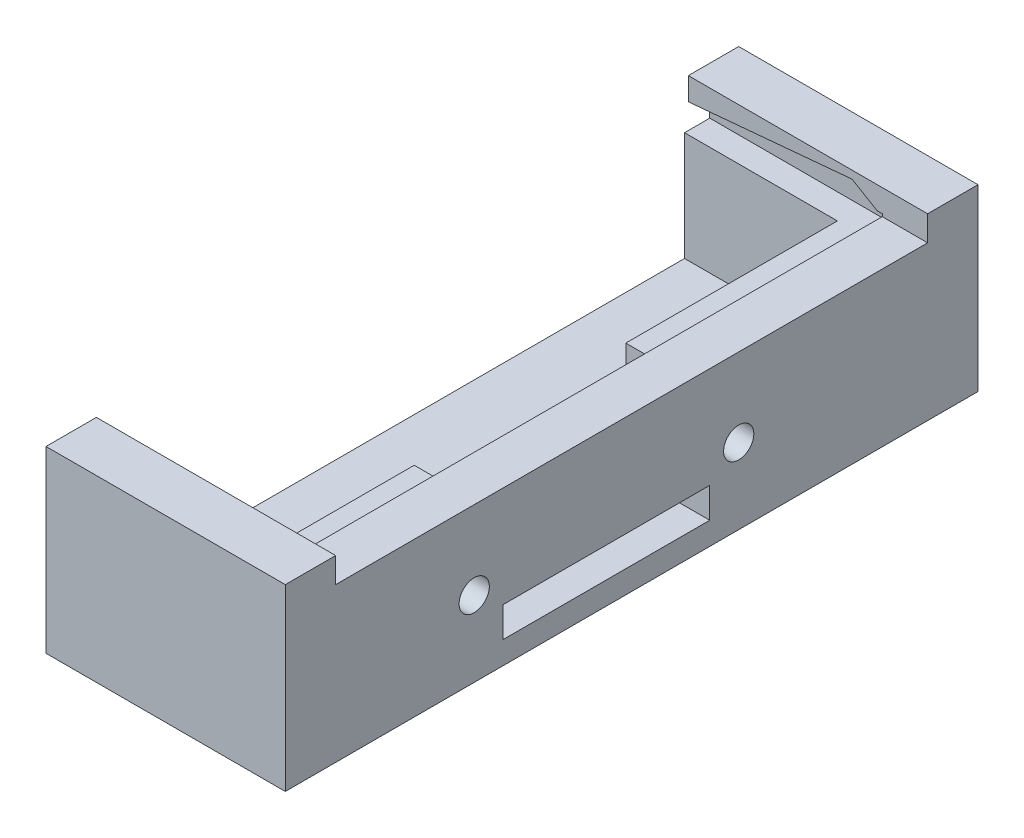
from build123d import *

# Parameters (mm, degrees)
BOSS_EXTRUDE1_DEPTH      = 5.08
BOSS_EXTRUDE1_DEPTH_BACK = 19.05
SKETCH1_W                = 69.85
SKETCH1_H                = 18.0655
CUT_EXTRUDE1_DEPTH       = 0.254
CUT_EXTRUDE1_DEPTH_BACK  = 2.254
SKETCH2_W                = 97.536
SKETCH2_H                = 64.008
CUT_EXTRUDE2_DEPTH       = 73.185536469
CUT_EXTRUDE2_DEPTH_BACK  = 73.185536469
SKETCH3_W                = 20.828
SKETCH3_H                = 3.048
CUT_EXTRUDE3_START       = -2.54
SKETCH4_W                = 24.13
SKETCH4_H                = 59.69
CUT_EXTRUDE3_DEPTH       = 2.54
CUT_EXTRUDE4_REACH       = 72.602
SKETCH5_W                = 18.459621809
SKETCH5_H                = 21.336
SKETCH6_W                = 58.928
SKETCH6_H                = 10.9855
CUT_EXTRUDE5_DEPTH       = 15.411621809
SKETCH7_R                = 1.524
CUT_EXTRUDE6_DEPTH       = 73.185536469
CUT_EXTRUDE7_DEPTH       = 2.159
CUT_EXTRUDE9_START       = 59.69
CUT_EXTRUDE9_DEPTH       = 2.159


with BuildPart() as part:
    # Sketch1 → Boss-Extrude1 (new, two sides: drawn at the far end of the back side and taken through both)
    with BuildSketch(Plane(origin=(0, 0, 0), x_dir=(0, 0, -1), z_dir=(1, 0, 0)).offset(-BOSS_EXTRUDE1_DEPTH_BACK)):
        with Locations((31.75, -4.49275)):
            Rectangle(SKETCH1_W, SKETCH1_H)
    extrude(amount=BOSS_EXTRUDE1_DEPTH + BOSS_EXTRUDE1_DEPTH_BACK)

    # Sketch2 → Cut-Extrude1 (cut, two sides: drawn at the far end of the back side and taken through both)
    with BuildSketch(Plane(origin=(0, 2, 0), x_dir=(1, 0, 0), z_dir=(0, 1, 0)).offset(-CUT_EXTRUDE1_DEPTH_BACK)):
        with Locations((-48.26, 31.75)):
            Rectangle(SKETCH2_W, SKETCH2_H)
    extrude(amount=CUT_EXTRUDE1_DEPTH + CUT_EXTRUDE1_DEPTH_BACK, mode=Mode.SUBTRACT)

    # Sketch3 → Cut-Extrude2 (cut, two sides: drawn at the far end of the back side and taken through both)
    with BuildSketch(Plane(origin=(5.08, 0, 0), x_dir=(0, 0, -1), z_dir=(1, 0, 0)).offset(-CUT_EXTRUDE2_DEPTH_BACK)):
        with Locations((29.21, -9.7155)):
            Rectangle(SKETCH3_W, SKETCH3_H)
    extrude(amount=CUT_EXTRUDE2_DEPTH + CUT_EXTRUDE2_DEPTH_BACK, mode=Mode.SUBTRACT)

    # Sketch4 → Cut-Extrude3 (cut)
    with BuildSketch(Plane(origin=(0, 4.54, 0), x_dir=(1, 0, 0), z_dir=(0, 1, 0)).offset(CUT_EXTRUDE3_START)):
        with Locations((-6.985, 31.75)):
            Rectangle(SKETCH4_W, SKETCH4_H)
    extrude(amount=CUT_EXTRUDE3_DEPTH, mode=Mode.SUBTRACT)

    # Cut-Extrude4: up to this face of the body (flat: up to its plane)
    cut_extrude4_end = Plane(part.part.faces().sort_by_distance((-6.985, -11.2395, -29.21))[0])
    # Sketch5 → Cut-Extrude4 (cut, up to the picked face)
    with BuildSketch(Plane(origin=(0, -0.254, 0), x_dir=(1, 0, 0), z_dir=(0, 1, 0)), mode=Mode.PRIVATE) as cut_extrude4_sk1:
        with Locations((-9.820189095, 29.21)):
            Rectangle(SKETCH5_W, SKETCH5_H)
    cut_extrude4_tool1 = split(extrude(cut_extrude4_sk1.sketch, amount=-CUT_EXTRUDE4_REACH, mode=Mode.PRIVATE), bisect_by=cut_extrude4_end, keep=Keep.BOTH, mode=Mode.PRIVATE)
    add(cut_extrude4_tool1.solids().sort_by(Axis((-9.820189, -0.254, -29.21), (0, -1, 0)))[0], mode=Mode.SUBTRACT)

    # Sketch6 → Cut-Extrude5 (cut)
    with BuildSketch(Plane.ZY.offset(19.05)):
        with Locations((-31.75, -5.74675)):
            Rectangle(SKETCH6_W, SKETCH6_H)
    extrude(amount=-CUT_EXTRUDE5_DEPTH, mode=Mode.SUBTRACT)

    # Sketch7 → Cut-Extrude6 (cut, through all)
    with BuildSketch(Plane(origin=(5.08, 0, 0), x_dir=(0, 0, -1), z_dir=(1, 0, 0))):
        with Locations((15.875, -5.9055)):
            Circle(SKETCH7_R)
        with Locations((42.545, -5.9055)):
            Circle(SKETCH7_R)
    extrude(amount=-CUT_EXTRUDE6_DEPTH, mode=Mode.SUBTRACT)

    # Sketch8 → Cut-Extrude7 (cut)
    with BuildSketch(Plane.XY.offset(-61.595)):
        Polygon((-19.05, 2.254), (-2.54, 3.754), (0, 2.254), align=None)
    extrude(amount=-CUT_EXTRUDE7_DEPTH, mode=Mode.SUBTRACT)

    # Sketch8<2> → Cut-Extrude9 (cut)
    with BuildSketch(Plane.XY.offset(-61.595).offset(CUT_EXTRUDE9_START)):
        Polygon((-19.05, 2.254), (-2.54, 3.754), (0, 2.254), align=None)
    extrude(amount=CUT_EXTRUDE9_DEPTH, mode=Mode.SUBTRACT)


solid = part.part
